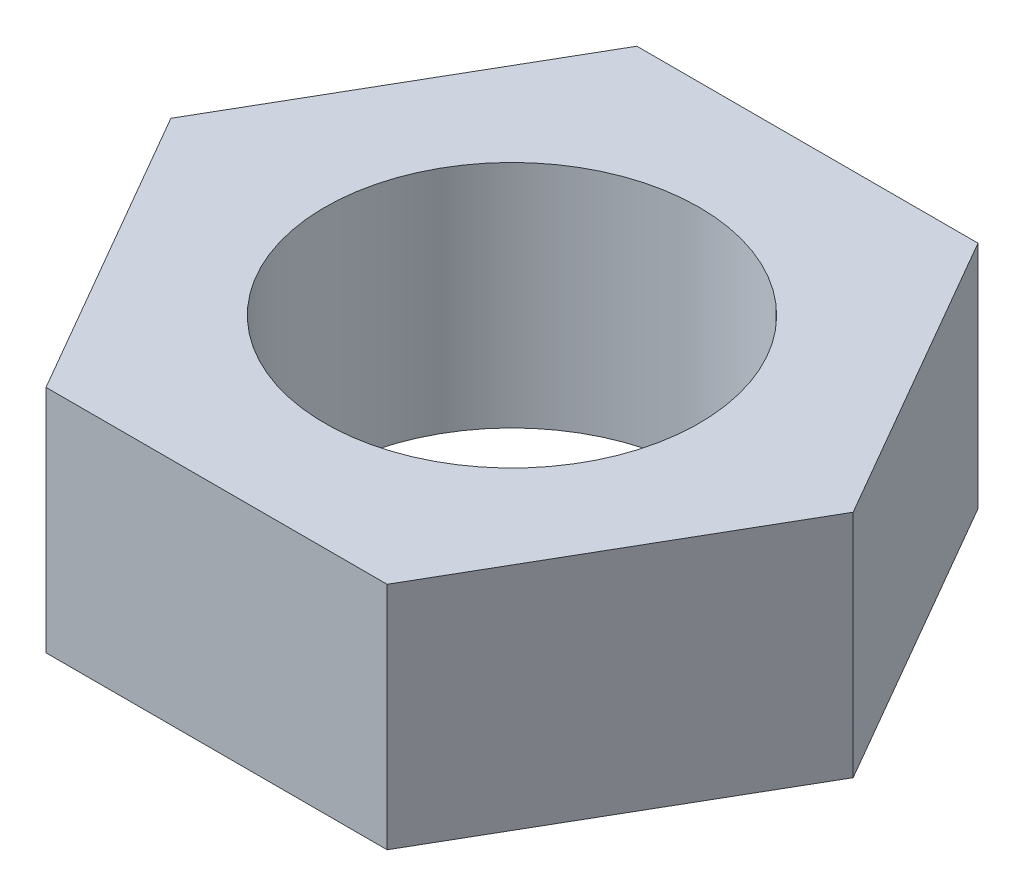
from build123d import *

# Parameters (mm, degrees)
SKETCH1_R           = 3.5
BOSS_EXTRUDE1_DEPTH = 4.3


with BuildPart() as part:
    # Sketch1 → Boss-Extrude1 (new body)
    with BuildSketch(Plane(origin=(0, 0, 0), x_dir=(1, 0, 0), z_dir=(0, 1, 0))):
        Polygon((3.189860237, -5.525), (6.379720475, 0), (3.189860237, 5.525), (-3.189860237, 5.525), (-6.379720475, 0), (-3.189860237, -5.525), align=None)
        with Locations(Location((0, 0, 0), (0, 0, 90))):
            Circle(SKETCH1_R, mode=Mode.SUBTRACT)
    extrude(amount=BOSS_EXTRUDE1_DEPTH)


solid = part.part
